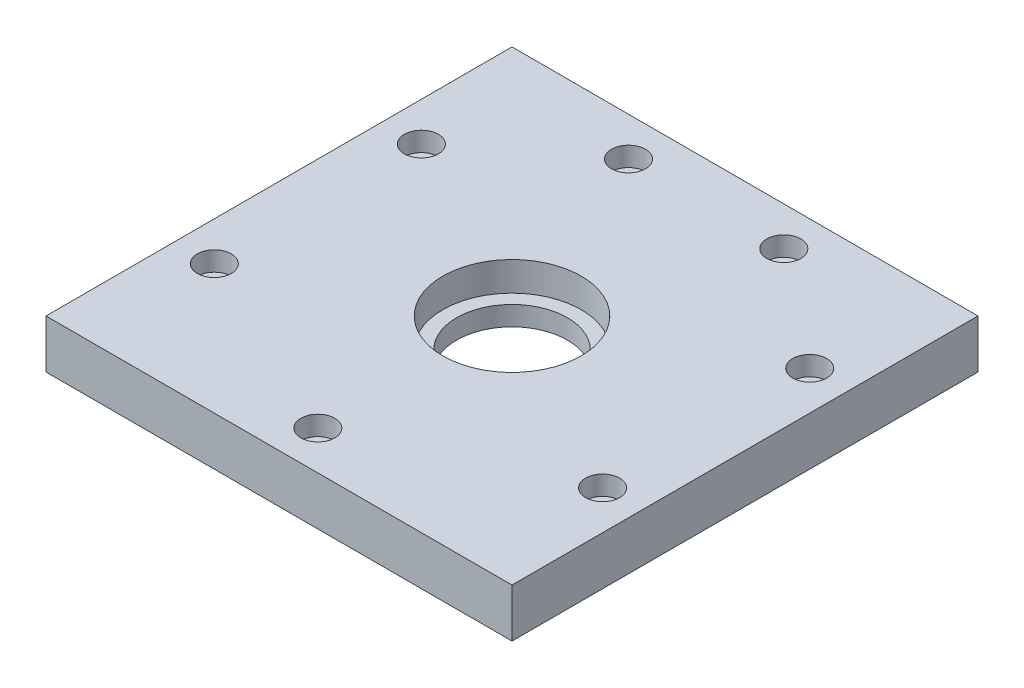
from build123d import *

# Parameters (mm, degrees)
SKETCH3_W                                        = 152.4
SKETCH3_H                                        = 15.875
BOSS_EXTRUDE1_DEPTH                              = 76.2
SKETCH4_R                                        = 22.621875
CUT_EXTRUDE1_DEPTH                               = 9.525
SKETCH5_R                                        = 18.0975
CUT_EXTRUDE2_DEPTH                               = 109.183203987
CBORE_FOR_1_4_SOCKET_HEAD_CAP_SCREW1_D           = 6.7564
CBORE_FOR_1_4_SOCKET_HEAD_CAP_SCREW1_CBORE_D     = 11.1125
CBORE_FOR_1_4_SOCKET_HEAD_CAP_SCREW1_CBORE_DEPTH = 6.35


with BuildPart() as part:
    # Sketch3 → Boss-Extrude1 (new, symmetric)
    with BuildSketch(Plane.XY):
        Rectangle(SKETCH3_W, SKETCH3_H)
    extrude(amount=BOSS_EXTRUDE1_DEPTH, both=True)

    # Sketch4 → Cut-Extrude1 (cut)
    with BuildSketch(Plane(origin=(0, 7.9375, 0), x_dir=(1, 0, 0), z_dir=(0, 1, 0))):
        with Locations(Location((0, 0, 0), (0, 0, 270))):
            Circle(SKETCH4_R)
    extrude(amount=-CUT_EXTRUDE1_DEPTH, mode=Mode.SUBTRACT)

    # Sketch5 → Cut-Extrude2 (cut, through all)
    with BuildSketch(Plane(origin=(0, -1.5875, 0), x_dir=(1, 0, 0), z_dir=(0, 1, 0))):
        with Locations(Location((0, 0, 0), (0, 0, 270))):
            Circle(SKETCH5_R)
    extrude(amount=-CUT_EXTRUDE2_DEPTH, mode=Mode.SUBTRACT)

    # CBORE for 1/4 Socket Head Cap Screw1 (through all)
    with Locations(Plane(origin=(-63.5, 7.9375, -33.866666667), x_dir=(0, 0, 1), z_dir=(0, 1, 0))):
        with Locations((0, 0), (-29.633333333, 38.1), (-29.633333333, 88.9), (0, 127), (67.733333334, 127), (97.366666667, 63.5), (67.733333334, 0)):
            CounterBoreHole(CBORE_FOR_1_4_SOCKET_HEAD_CAP_SCREW1_D / 2, CBORE_FOR_1_4_SOCKET_HEAD_CAP_SCREW1_CBORE_D / 2, CBORE_FOR_1_4_SOCKET_HEAD_CAP_SCREW1_CBORE_DEPTH)


solid = part.part
